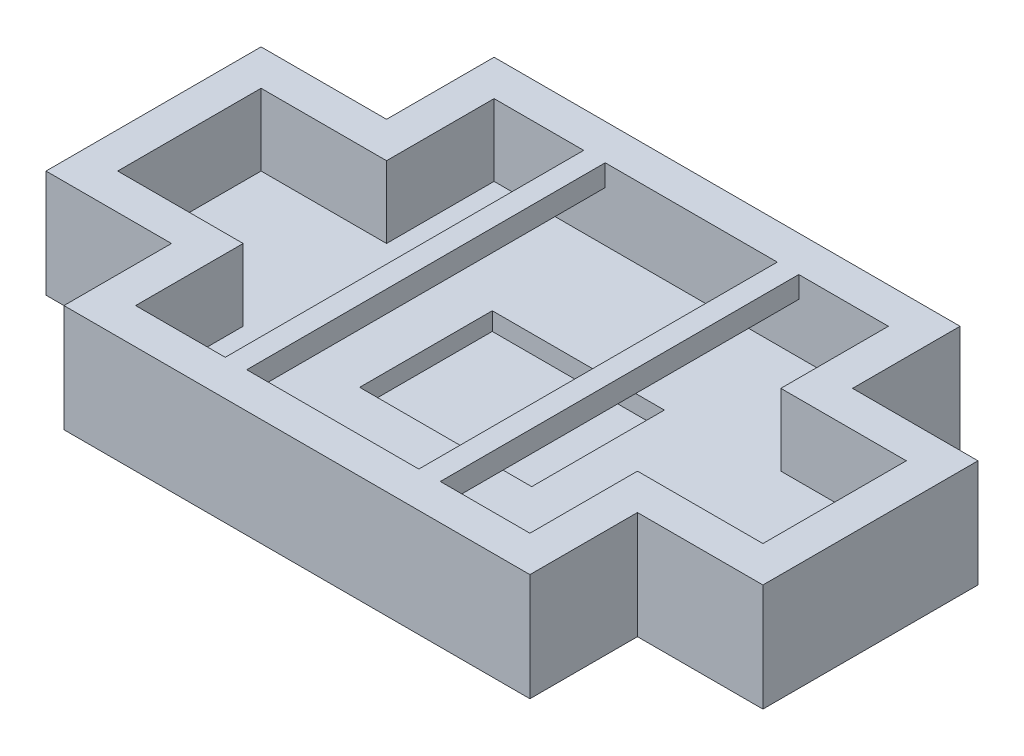
from build123d import *

# Parameters (mm, degrees)
SKETCH1_W           = 650
SKETCH1_H           = 300
SKETCH1_W_2         = 175
SKETCH1_H_2         = 150
BOSS_EXTRUDE1_DEPTH = 75
SKETCH2_W           = 240
SKETCH2_H           = 185
CUT_EXTRUDE1_DEPTH  = 125
CUT_EXTRUDE2_DEPTH  = 100
SKETCH4_W           = 30
SKETCH4_H           = 500
BOSS_EXTRUDE2_DEPTH = 30


with BuildPart() as part:
    # Sketch1 → Boss-Extrude1 (new, symmetric)
    with BuildSketch(Plane(origin=(0, 0, 0), x_dir=(1, 0, 0), z_dir=(0, 1, 0))):
        Rectangle(SKETCH1_W, SKETCH1_H)
        with Locations((-412.5, 0)):
            Rectangle(SKETCH1_W_2, SKETCH1_H)
        with Locations((0, -225)):
            Rectangle(SKETCH1_W, SKETCH1_H_2)
        with Locations((412.5, 0)):
            Rectangle(SKETCH1_W_2, SKETCH1_H)
        with Locations((0, 225)):
            Rectangle(SKETCH1_W, SKETCH1_H_2)
    extrude(amount=BOSS_EXTRUDE1_DEPTH, both=True)

    # Sketch2 → Cut-Extrude1 (cut)
    with BuildSketch(Plane(origin=(0, 75, 0), x_dir=(1, 0, 0), z_dir=(0, 1, 0))):
        Rectangle(SKETCH2_W, SKETCH2_H)
    extrude(amount=-CUT_EXTRUDE1_DEPTH, mode=Mode.SUBTRACT)

    # Sketch3 → Cut-Extrude2 (cut)
    with BuildSketch(Plane(origin=(0, 75, 0), x_dir=(1, 0, 0), z_dir=(0, 1, 0))):
        Polygon((-450, 100), (-275, 100), (-275, 250), (275, 250), (275, 100), (450, 100), (450, -100), (275, -100), (275, -250), (-275, -250), (-275, -100), (-450, -100), align=None)
    extrude(amount=-CUT_EXTRUDE2_DEPTH, mode=Mode.SUBTRACT)

    # Sketch4 → Boss-Extrude2 (add)
    with BuildSketch(Plane(origin=(0, 75, 0), x_dir=(1, 0, 0), z_dir=(0, 1, 0))):
        with Locations((-135, 0)):
            Rectangle(SKETCH4_W, SKETCH4_H)
        with Locations((135, 0)):
            Rectangle(SKETCH4_W, SKETCH4_H)
    extrude(amount=-BOSS_EXTRUDE2_DEPTH)


solid = part.part
